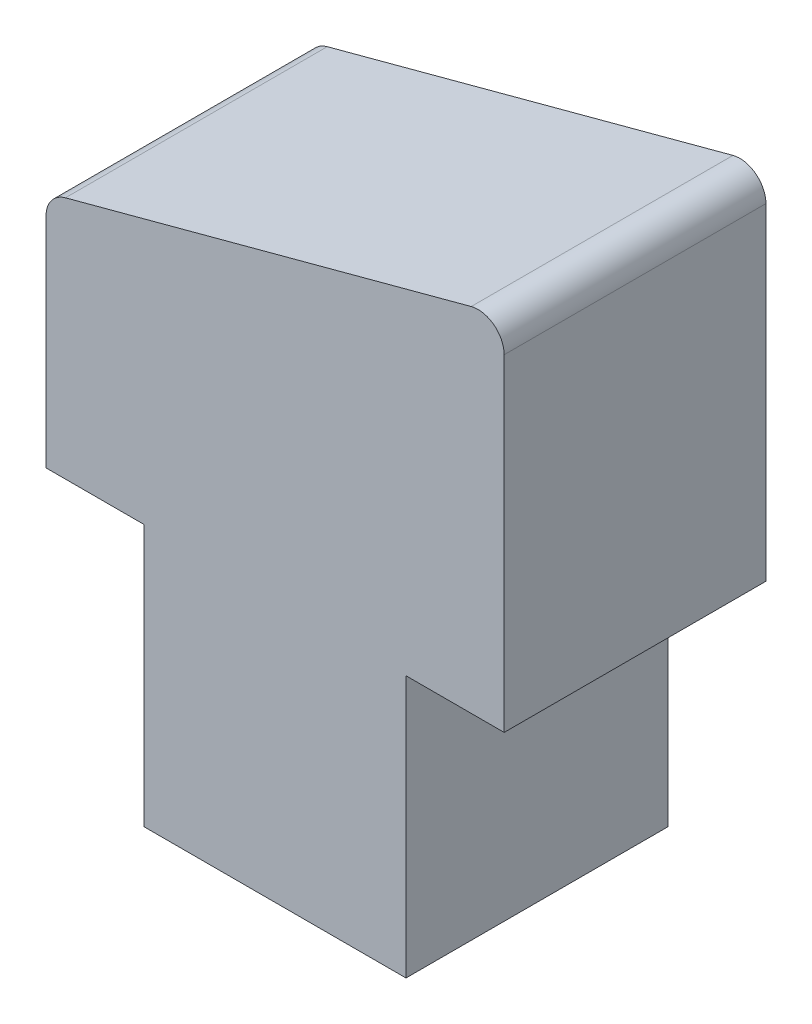
from build123d import *

# Parameters (mm, degrees)
SKETCH2_W           = 150
SKETCH2_H           = 60
EXTRUDE1_DEPTH      = 20
SKETCH3_W           = 20.4
SKETCH3_H           = 20.4
EXTRUDE2_DEPTH      = 20
EXTRUDE3_DEPTH      = 10
EXTRUDE4_DEPTH      = 98.418669917
EXTRUDE4_DEPTH_BACK = 98.418669917
SKETCH5_W           = 75
SKETCH5_H           = 27.596189432
SKETCH6_W           = 20
SKETCH6_H           = 20
EXTRUDE5_DEPTH      = 20
FILLET1_R           = 2


with BuildPart() as part:
    # Sketch2 → Extrude1 (new body)
    with BuildSketch(Plane(origin=(0, 0, 0), x_dir=(1, 0, 0), z_dir=(0, 1, 0))):
        Rectangle(SKETCH2_W, SKETCH2_H)
    extrude(amount=EXTRUDE1_DEPTH)

    # Sketch3 → Extrude2 (cut)
    with BuildSketch(Plane(origin=(0, 20, 0), x_dir=(1, 0, 0), z_dir=(0, 1, 0))):
        with Locations((0, 12.9)):
            Rectangle(SKETCH3_W, SKETCH3_H)
        with Locations((0, -12.9)):
            Rectangle(SKETCH3_W, SKETCH3_H)
    extrude(amount=-EXTRUDE2_DEPTH, mode=Mode.SUBTRACT)

    # Sketch4 → Extrude3 (add, symmetric)
    with BuildSketch(Plane.XY):
        Polygon((-75, 20), (-75, 47.596189432), (-40, 38.217967697), (-40, 20), align=None)
    extrude3 = extrude(amount=EXTRUDE3_DEPTH, both=True)

    # Mirror1: Extrude3 across plane
    add(extrude3.mirror(Plane(origin=(0, 0, 0), x_dir=(0, 0, 1), z_dir=(1, 0, 0))))

    # Sketch5 → Extrude4 (cut, two sides: drawn at the far end of the back side and taken through both)
    with BuildSketch(Plane(origin=(0, 0, -10), x_dir=(-1, 0, 0), z_dir=(0, 0, -1)).offset(-EXTRUDE4_DEPTH_BACK)):
        Polygon((-40, 20), (-75, 20), (-75, 0), (75, 0), (75, 20), (0, 20), align=None)
        with Locations((37.5, 33.798094716)):
            Rectangle(SKETCH5_W, SKETCH5_H)
    extrude(amount=EXTRUDE4_DEPTH + EXTRUDE4_DEPTH_BACK, mode=Mode.SUBTRACT)

    # Sketch6 → Extrude5 (add)
    with BuildSketch(Plane.XZ.offset(-20)):
        with Locations((57.5, 0)):
            Rectangle(SKETCH6_W, SKETCH6_H)
    extrude(amount=EXTRUDE5_DEPTH)

    # Fillet1
    fillet1_edges = [part.edges().sort_by_distance(p)[0] for p in [
        (75, 47.596189432, 0),
        (40, 38.217967697, 0),
    ]]
    fillet(fillet1_edges, radius=FILLET1_R)


solid = part.part
